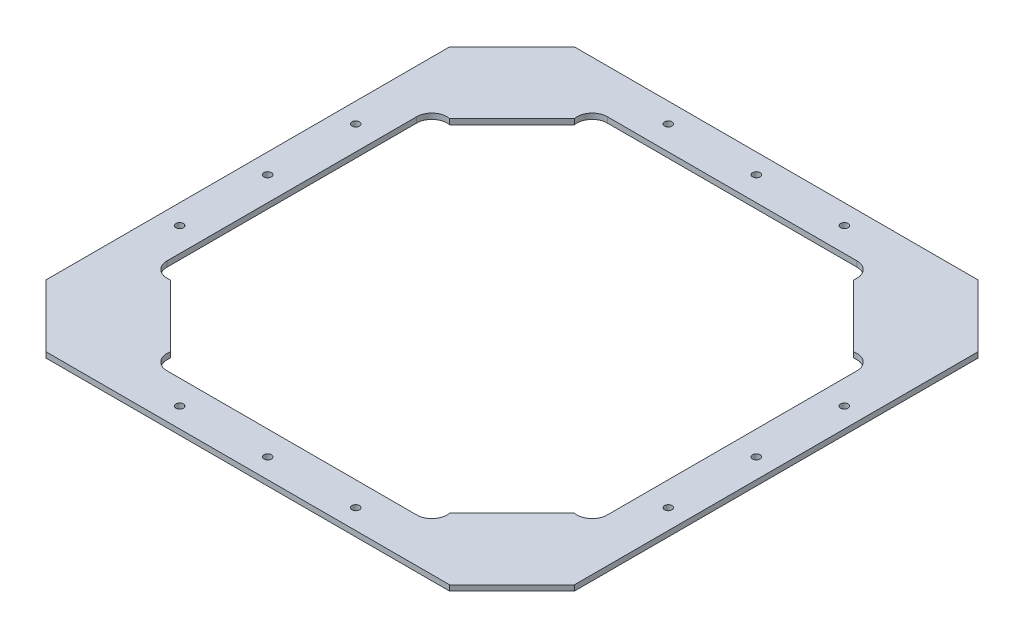
from build123d import *

# Parameters (mm, degrees)
BOSS_EXTRUDE1_DEPTH = 3.175
SKETCH4_R           = 2.159
CUT_EXTRUDE2_DEPTH  = 216.549531721


with BuildPart() as part:
    # Sketch2 → Boss-Extrude1 (new body)
    with BuildSketch(Plane(origin=(0, 0, 0), x_dir=(1, 0, 0), z_dir=(0, 1, 0))):
        Polygon((-152.4, 116.478975516), (-116.478975516, 152.4), (116.478975516, 152.4), (152.4, 116.478975516), (152.4, -116.478975516), (116.478975516, -152.4), (-116.478975516, -152.4), (-152.4, -116.478975516), align=None)
        with BuildLine():
            Line((-116.478975516, 80.557951031), (-80.557951031, 116.478975516))
            ThreePointArc((-80.557951031, 116.478975516), (-78.800891411, 123.772159882), (-72.028975516, 127))
            Line((-72.028975516, 127), (-59.328975516, 127))
            Line((-59.328975516, 127), (59.328975516, 127))
            Line((59.328975516, 127), (72.028975516, 127))
            ThreePointArc((72.028975516, 127), (78.800891411, 123.772159882), (80.557951031, 116.478975516))
            Line((80.557951031, 116.478975516), (116.478975516, 80.557951031))
            ThreePointArc((116.478975516, 80.557951031), (123.772159882, 78.800891411), (127, 72.028975516))
            Line((127, 72.028975516), (127, 59.328975516))
            Line((127, 59.328975516), (127, -59.328975516))
            Line((127, -59.328975516), (127, -72.028975516))
            ThreePointArc((127, -72.028975516), (123.772159882, -78.800891411), (116.478975516, -80.557951031))
            Line((116.478975516, -80.557951031), (80.557951031, -116.478975516))
            ThreePointArc((80.557951031, -116.478975516), (78.800891411, -123.772159882), (72.028975516, -127))
            Line((72.028975516, -127), (59.328975516, -127))
            Line((59.328975516, -127), (-59.328975516, -127))
            Line((-59.328975516, -127), (-72.028975516, -127))
            ThreePointArc((-72.028975516, -127), (-78.800891411, -123.772159882), (-80.557951031, -116.478975516))
            Line((-80.557951031, -116.478975516), (-116.478975516, -80.557951031))
            ThreePointArc((-116.478975516, -80.557951031), (-123.772159882, -78.800891411), (-127, -72.028975516))
            Line((-127, -72.028975516), (-127, -59.328975516))
            Line((-127, -59.328975516), (-127, 59.328975516))
            Line((-127, 59.328975516), (-127, 72.028975516))
            ThreePointArc((-127, 72.028975516), (-123.772159882, 78.800891411), (-116.478975516, 80.557951031))
        make_face(mode=Mode.SUBTRACT)
    extrude(amount=BOSS_EXTRUDE1_DEPTH)

    # Sketch4 → Cut-Extrude2 (cut, through all)
    with BuildSketch(Plane(origin=(0, 3.175, 0), x_dir=(1, 0, 0), z_dir=(0, 1, 0))):
        with Locations(Location((0, 140.97, 0), (0, 0, 270))):
            Circle(SKETCH4_R)
        with Locations(Location((-50.8, 140.97, 0), (0, 0, 270))):
            Circle(SKETCH4_R)
        with Locations(Location((-140.97, 50.8, 0), (0, 0, 270))):
            Circle(SKETCH4_R)
        with Locations(Location((-140.97, 0, 0), (0, 0, 270))):
            Circle(SKETCH4_R)
        with Locations(Location((140.97, 0, 0), (0, 0, 90))):
            Circle(SKETCH4_R)
        with Locations(Location((140.97, 50.8, 0), (0, 0, 90))):
            Circle(SKETCH4_R)
        with Locations(Location((50.8, 140.97, 0), (0, 0, 90))):
            Circle(SKETCH4_R)
        with Locations(Location((50.8, -140.97, 0), (0, 0, 270))):
            Circle(SKETCH4_R)
        with Locations(Location((140.97, -50.8, 0), (0, 0, 270))):
            Circle(SKETCH4_R)
        with Locations(Location((-50.8, -140.97, 0), (0, 0, 90))):
            Circle(SKETCH4_R)
        with Locations(Location((0, -140.97, 0), (0, 0, 90))):
            Circle(SKETCH4_R)
        with Locations(Location((-140.97, -50.8, 0), (0, 0, 90))):
            Circle(SKETCH4_R)
    extrude(amount=-CUT_EXTRUDE2_DEPTH, mode=Mode.SUBTRACT)


solid = part.part
